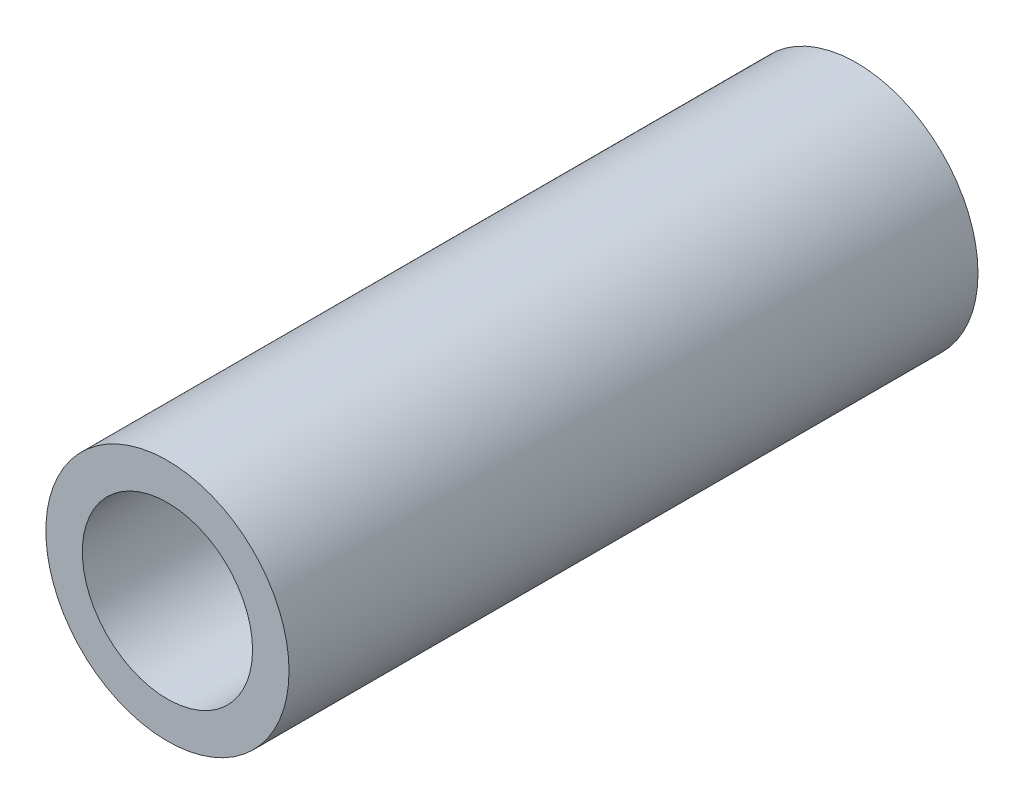
from build123d import *

# Parameters (mm, degrees)
SKETCH1_R           = 3
SKETCH1_R_2         = 2.1
BOSS_EXTRUDE1_DEPTH = 17


with BuildPart() as part:
    # Sketch1 → Boss-Extrude1 (new body)
    with BuildSketch(Plane.XY):
        Circle(SKETCH1_R)
        Circle(SKETCH1_R_2, mode=Mode.SUBTRACT)
    extrude(amount=BOSS_EXTRUDE1_DEPTH)


solid = part.part
